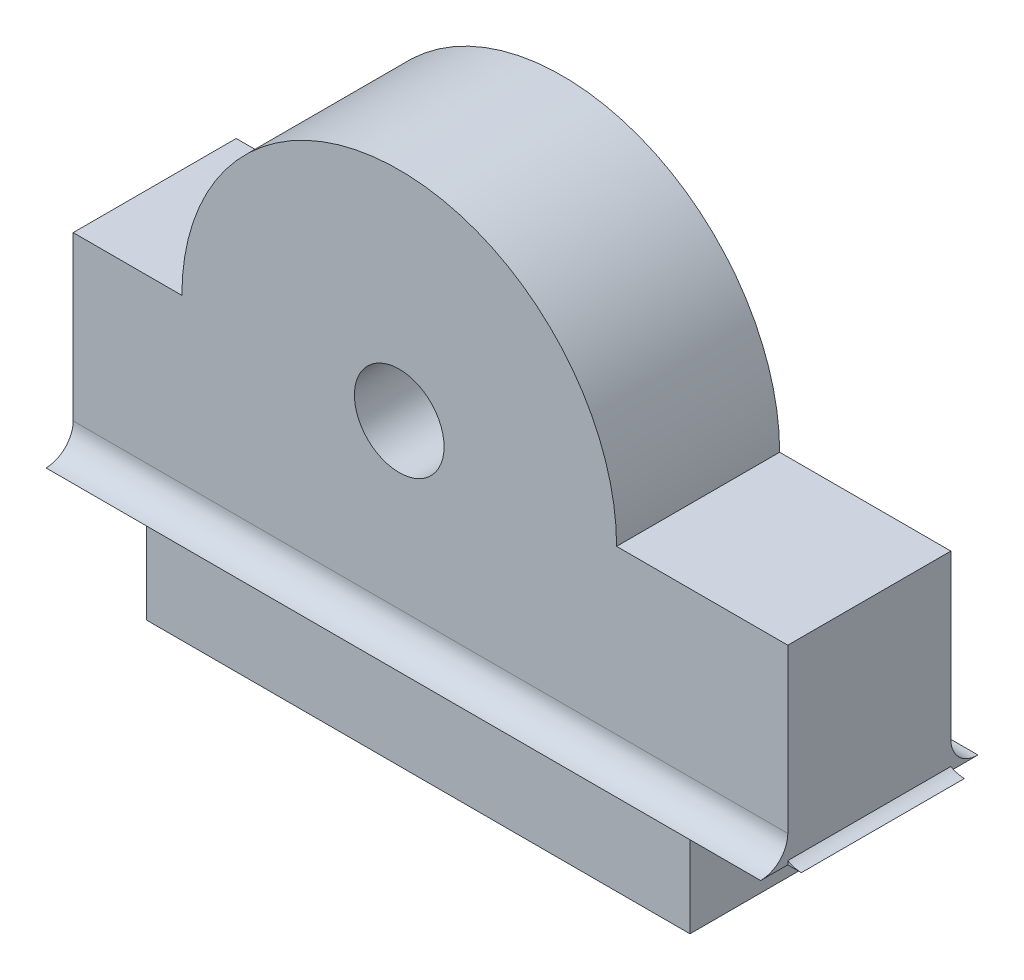
from build123d import *

# Parameters (mm, degrees)
SKETCH1_R           = 2.9
BOSS_EXTRUDE1_DEPTH = 6
BOSS_EXTRUDE2_DEPTH = 26.3
BOSS_EXTRUDE3_DEPTH = 6
SKETCH5_R           = 2.9
SKETCH5_R_2         = 1.65
BOSS_EXTRUDE4_DEPTH = 3
SKETCH7_R           = 2.9
CUT_EXTRUDE1_DEPTH  = 10
BOSS_EXTRUDE5_START = -3
SKETCH6_R           = 2.9
SKETCH6_R_2         = 1.65
BOSS_EXTRUDE5_DEPTH = 3


with BuildPart() as part:
    # Sketch1 → Boss-Extrude1 (new body)
    with BuildSketch(Plane.XY):
        with BuildLine():
            Line((0, 0), (20, 0))
            Line((20, 0), (20, 4))
            Line((20, 4), (23.6, 4))
            Line((23.6, 4), (23.6, 11))
            Line((23.6, 11), (17.3, 11))
            ThreePointArc((17.3, 11), (9.3, 19), (1.3, 11))
            Line((1.3, 11), (-2.7, 11))
            Line((-2.7, 11), (-2.7, 4))
            Line((-2.7, 4), (0, 4))
            Line((0, 4), (0, 0))
        make_face()
        with Locations((9.3, 11)):
            Circle(SKETCH1_R, mode=Mode.SUBTRACT)
    extrude(amount=BOSS_EXTRUDE1_DEPTH)

    # Sketch2 → Boss-Extrude2 (add)
    with BuildSketch(Plane.ZY.offset(2.7)):
        with BuildLine():
            Line((6, 4), (6, 5))
            ThreePointArc((6, 5), (6.292893219, 4.292893219), (7, 4))
            Line((7, 4), (6, 4))
        make_face()
        with BuildLine():
            Line((0, 4), (-1, 4))
            ThreePointArc((-1, 4), (-0.292893219, 4.292893219), (0, 5))
            Line((0, 5), (0, 4))
        make_face()
    extrude(amount=-BOSS_EXTRUDE2_DEPTH)

    # Sketch4 → Boss-Extrude3 (add)
    with BuildSketch(Plane.XY.offset(6)):
        with BuildLine():
            Line((23.1, 4), (23.1, 5))
            ThreePointArc((23.1, 5), (23.392893219, 4.292893219), (24.1, 4))
            Line((24.1, 4), (23.1, 4))
        make_face()
        with BuildLine():
            Line((-1.5, 4), (-2.5, 4))
            ThreePointArc((-2.5, 4), (-1.792893219, 4.292893219), (-1.5, 5))
            Line((-1.5, 5), (-1.5, 4))
        make_face()
    extrude(amount=-BOSS_EXTRUDE3_DEPTH)

    # Sketch5 → Boss-Extrude4 (add)
    with BuildSketch(Plane(origin=(0, 0, 0), x_dir=(-1, 0, 0), z_dir=(0, 0, -1))):
        with Locations((-9.3, 11)):
            Circle(SKETCH5_R)
        with Locations((-9.3, 11)):
            Circle(SKETCH5_R_2, mode=Mode.SUBTRACT)
    extrude(amount=-BOSS_EXTRUDE4_DEPTH)

    # Sketch7 → Cut-Extrude1 (cut)
    with BuildSketch(Plane(origin=(0, 0, 0), x_dir=(-1, 0, 0), z_dir=(0, 0, -1))):
        with Locations((-9.3, 11)):
            Circle(SKETCH7_R)
    extrude(amount=-CUT_EXTRUDE1_DEPTH, mode=Mode.SUBTRACT)

    # Sketch6 → Boss-Extrude5 (add)
    with BuildSketch(Plane.XY.offset(6).offset(BOSS_EXTRUDE5_START)):
        with Locations(Location((9.3, 11, 0), (0, 0, 180))):
            Circle(SKETCH6_R)
        with Locations((9.3, 11)):
            Circle(SKETCH6_R_2, mode=Mode.SUBTRACT)
    extrude(amount=BOSS_EXTRUDE5_DEPTH)


solid = part.part
